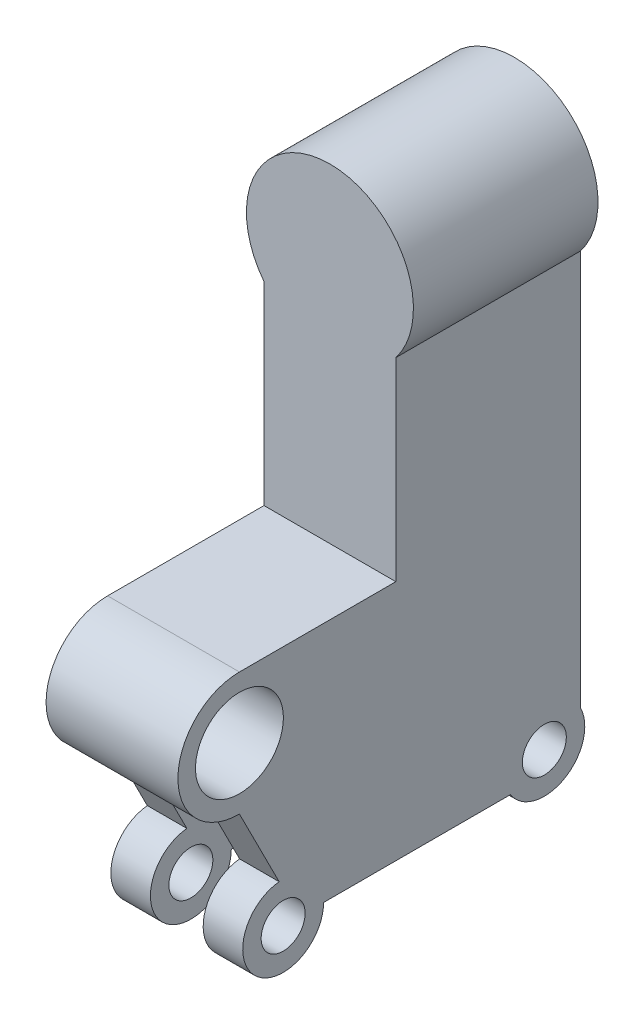
from build123d import *

# Parameters (mm, degrees)
SKETCH1_R           = 5
SKETCH1_R_2         = 2.5
BOSS_EXTRUDE2_DEPTH = 15
SKETCH2_W           = 6
SKETCH2_H           = 38.915837439
CUT_EXTRUDE1_DEPTH  = 11
CUT_EXTRUDE2_START  = -4.5
SKETCH3_R           = 4.6
SKETCH3_R_2         = 2.5
CUT_EXTRUDE2_DEPTH  = 6
CUT_EXTRUDE3_START  = -10.5
SKETCH4_R           = 4.6
SKETCH4_R_2         = 2.5
CUT_EXTRUDE3_DEPTH  = 6
BOSS_EXTRUDE3_DEPTH = 21
CUT_EXTRUDE4_DEPTH  = 67.015153021
BOSS_EXTRUDE4_START = -15.5
SKETCH8_R           = 6
BOSS_EXTRUDE4_DEPTH = 5.5


with BuildPart() as part:
    # Sketch1 → Boss-Extrude2 (new body)
    with BuildSketch(Plane(origin=(0, 0, 0), x_dir=(0, 0, -1), z_dir=(1, 0, 0))):
        with BuildLine():
            Line((0, -7), (4.514898748, -15.922762425))
            ThreePointArc((4.514898748, -15.922762425), (1.88507796, -23.910457261), (9.571950369, -20.5))
            Line((9.571950369, -20.5), (30.826440892, -20.5))
            ThreePointArc((30.826440892, -20.5), (36.979627599, -21.988417026), (38.792064121, -15.922762425))
            Line((38.792064121, -15.922762425), (38.792064121, 29.077237575))
            Line((38.792064121, 29.077237575), (17.792064121, 29.077237575))
            Line((17.792064121, 29.077237575), (17.792064121, 7))
            Line((17.792064121, 7), (0, 7))
            ThreePointArc((0, 7), (-7, 0), (0, -7))
        make_face()
        Circle(SKETCH1_R, mode=Mode.SUBTRACT)
        with Locations((4.971950369, -20.5)):
            Circle(SKETCH1_R_2, mode=Mode.SUBTRACT)
        with Locations((34.687787808, -18)):
            Circle(SKETCH1_R_2, mode=Mode.SUBTRACT)
    extrude(amount=BOSS_EXTRUDE2_DEPTH)

    # Sketch2 → Cut-Extrude1 (cut)
    with BuildSketch(Plane.XZ.offset(20.5)):
        with Locations((7.5, -19.829869089)):
            Rectangle(SKETCH2_W, SKETCH2_H)
    extrude(amount=-CUT_EXTRUDE1_DEPTH, mode=Mode.SUBTRACT)

    # Sketch3 → Cut-Extrude2 (cut)
    with BuildSketch(Plane.ZY.offset(CUT_EXTRUDE2_START)):
        with Locations((-4.971950369, -20.5)):
            Circle(SKETCH3_R)
        with Locations(Location((-4.971950369, -20.5, 0), (0, 0, 180))):
            Circle(SKETCH3_R_2, mode=Mode.SUBTRACT)
    extrude(amount=-CUT_EXTRUDE2_DEPTH, mode=Mode.SUBTRACT)

    # Sketch4 → Cut-Extrude3 (cut)
    with BuildSketch(Plane(origin=(15, 0, 0), x_dir=(0, 0, -1), z_dir=(1, 0, 0)).offset(CUT_EXTRUDE3_START)):
        with Locations((34.687787808, -18)):
            Circle(SKETCH4_R)
        with Locations((34.687787808, -18)):
            Circle(SKETCH4_R_2, mode=Mode.SUBTRACT)
    extrude(amount=CUT_EXTRUDE3_DEPTH, mode=Mode.SUBTRACT)

    # Sketch6 → Boss-Extrude3 (add)
    with BuildSketch(Plane(origin=(0, 0, -38.792064121), x_dir=(-1, 0, 0), z_dir=(0, 0, -1))):
        with BuildLine():
            ThreePointArc((0, 29.077237575), (-7.5, 44.40818947), (-15, 29.077237575))
            Line((-15, 29.077237575), (-8.914213562, 29.077237575))
            ThreePointArc((-8.914213562, 29.077237575), (-11.20909144, 39.624399885), (-1.5, 34.90818947))
            ThreePointArc((-1.5, 34.90818947), (-2.783789584, 31.199098029), (-6.085786438, 29.077237575))
            Line((-6.085786438, 29.077237575), (0, 29.077237575))
        make_face()
    extrude(amount=-BOSS_EXTRUDE3_DEPTH)

    # Sketch7 → Cut-Extrude4 (cut, through all)
    with BuildSketch(Plane(origin=(0, 0, -38.792064121), x_dir=(-1, 0, 0), z_dir=(0, 0, -1))):
        with BuildLine():
            Line((-8.914213562, 29.077237575), (-6.085786438, 29.077237575))
            ThreePointArc((-6.085786438, 29.077237575), (-7.5, 28.90818947), (-8.914213562, 29.077237575))
        make_face()
    extrude(amount=-CUT_EXTRUDE4_DEPTH, mode=Mode.SUBTRACT)

    # Sketch8 → Boss-Extrude4 (add)
    with BuildSketch(Plane(origin=(0, 0, -38.792064121), x_dir=(-1, 0, 0), z_dir=(0, 0, -1)).offset(BOSS_EXTRUDE4_START)):
        with Locations((-7.5, 34.90818947)):
            Circle(SKETCH8_R)
    extrude(amount=-BOSS_EXTRUDE4_DEPTH)


solid = part.part
